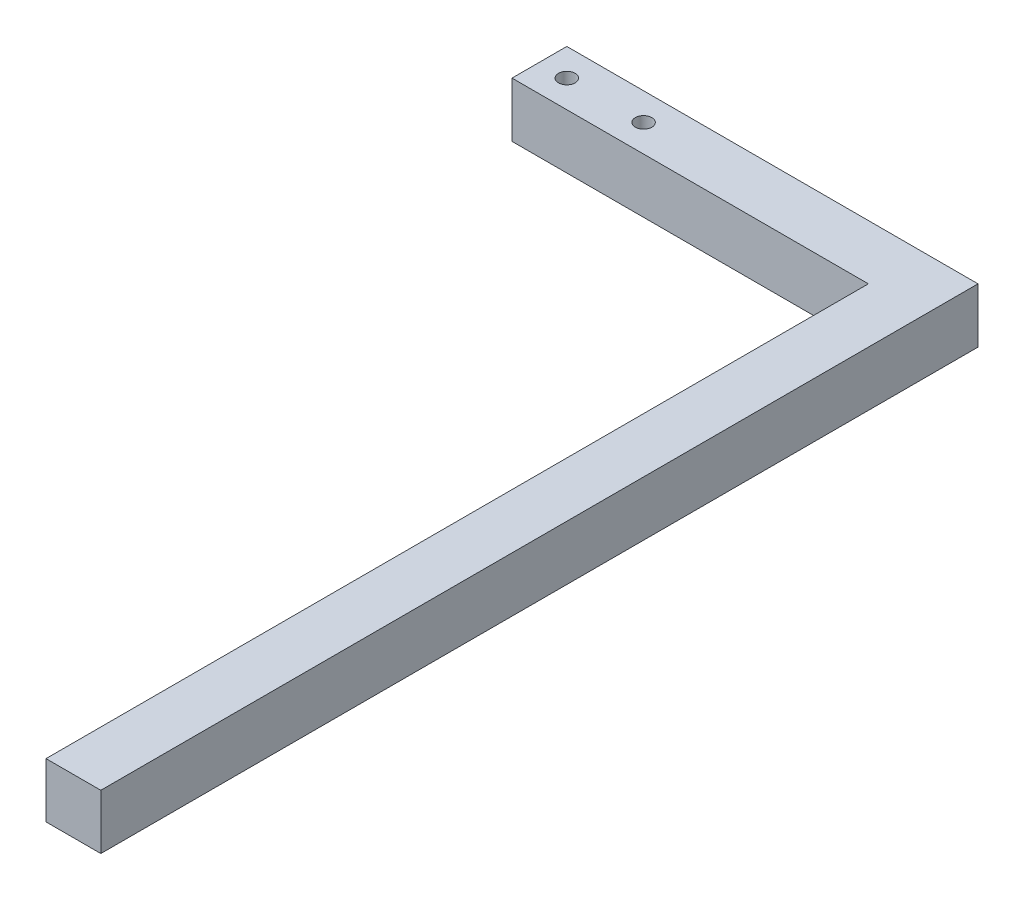
from build123d import *

# Parameters (mm, degrees)
SKETCH1_W           = 75
SKETCH1_H           = 10
SKETCH1_R           = 1.518320508
BOSS_EXTRUDE1_DEPTH = 10
SKETCH5_W           = 10
SKETCH5_H           = 10
BOSS_EXTRUDE3_DEPTH = 150


with BuildPart() as part:
    # Sketch1 → Boss-Extrude1 (new body)
    with BuildSketch(Plane(origin=(0, 0, 0), x_dir=(1, 0, 0), z_dir=(0, 1, 0))):
        with Locations((37.5, 5)):
            Rectangle(SKETCH1_W, SKETCH1_H)
        with Locations(Location((5, 5, 0), (0, 0, 270))):
            Circle(SKETCH1_R, mode=Mode.SUBTRACT)
        with Locations(Location((19, 5, 0), (0, 0, 270))):
            Circle(SKETCH1_R, mode=Mode.SUBTRACT)
    extrude(amount=BOSS_EXTRUDE1_DEPTH)

    # Sketch5 → Boss-Extrude3 (add)
    with BuildSketch(Plane.XY):
        with Locations((70, 5)):
            Rectangle(SKETCH5_W, SKETCH5_H)
    extrude(amount=BOSS_EXTRUDE3_DEPTH)


solid = part.part
